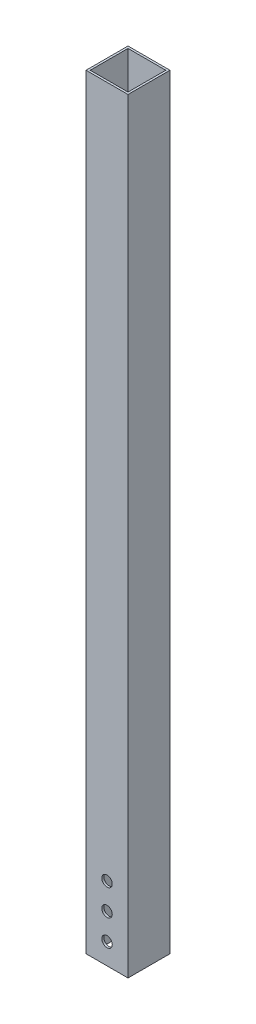
from build123d import *

# Parameters (mm, degrees)
SKETCH1_W             = 20
SKETCH1_H             = 20
SKETCH1_W_2           = 18
SKETCH1_H_2           = 18
F_20_X_20_X_2_1_DEPTH = 364.53
SKETCH_2_R            = 2.5
CUT_EXTRUDE_1_DEPTH   = 366.215170687


with BuildPart() as part:
    # Sketch1 → 方形管 20 X 20 X 2(1) (new body)
    with BuildSketch(Plane(origin=(0, 0, 0), x_dir=(-1, 0, 0), z_dir=(0, 1, 0))):
        Rectangle(SKETCH1_W, SKETCH1_H)
        Rectangle(SKETCH1_W_2, SKETCH1_H_2, mode=Mode.SUBTRACT)
    extrude(amount=F_20_X_20_X_2_1_DEPTH)

    # 草图2 → 切除-拉伸1 (cut, through all)
    with BuildSketch(Plane.XY.offset(10)):
        with Locations((0, 10)):
            Circle(SKETCH_2_R)
        with Locations((0, 22.5)):
            Circle(SKETCH_2_R)
        with Locations((0, 35)):
            Circle(SKETCH_2_R)
    extrude(amount=-CUT_EXTRUDE_1_DEPTH, mode=Mode.SUBTRACT)


solid = part.part
